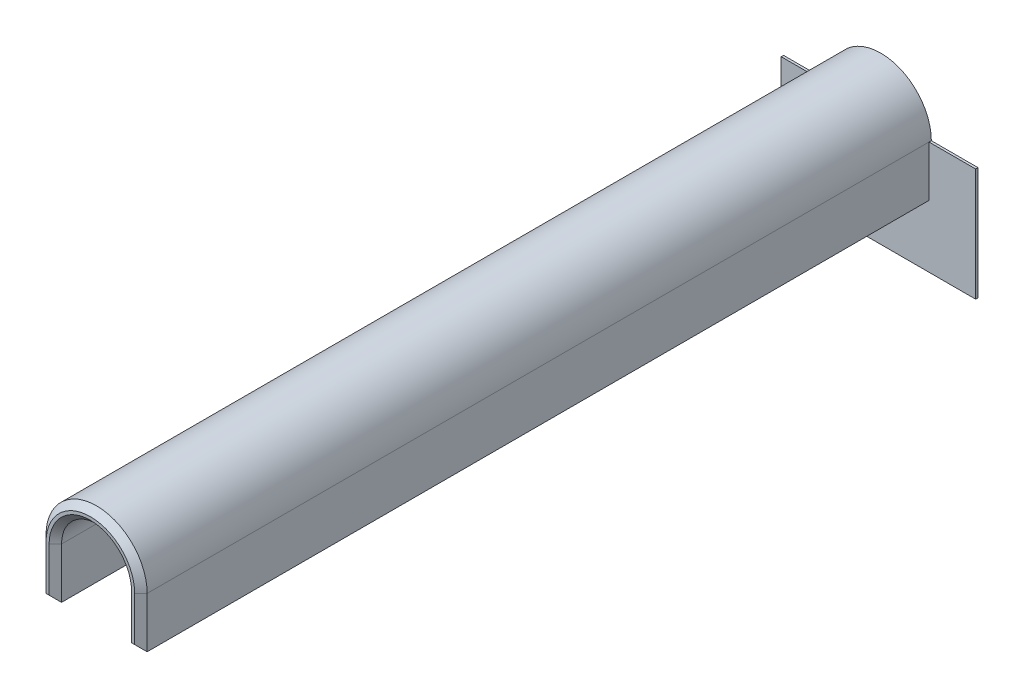
from build123d import *

# Parameters (mm, degrees)
BOSS_EXTRUDE1_DEPTH = 101.6
BOSS_EXTRUDE2_DEPTH = 0.3
CHAMFER1_SIZE       = 0.8


with BuildPart() as part:
    # Sketch1 → Boss-Extrude1 (new body)
    with BuildSketch(Plane.XY):
        with BuildLine():
            Line((-4.5, 0), (-4.5, -6.5))
            Line((-4.5, -6.5), (-6.5, -6.5))
            Line((-6.5, -6.5), (-6.5, 0))
            ThreePointArc((-6.5, 0), (0, 6.5), (6.5, 0))
            Line((6.5, 0), (6.5, -6.5))
            Line((6.5, -6.5), (4.5, -6.5))
            Line((4.5, -6.5), (4.5, 0))
            ThreePointArc((4.5, 0), (0, 4.5), (-4.5, 0))
        make_face()
    extrude(amount=BOSS_EXTRUDE1_DEPTH)

    # Sketch2 → Boss-Extrude2 (add)
    with BuildSketch(Plane(origin=(0, 0, 0), x_dir=(-1, 0, 0), z_dir=(0, 0, -1))):
        Polygon((4.5, 0), (4.5, -6.5), (-4.5, -6.5), (-4.5, 0), (-12.5, 0), (-12.5, -14.5), (12.5, -14.5), (12.5, 0), align=None)
    extrude(amount=-BOSS_EXTRUDE2_DEPTH)

    # Chamfer1
    chamfer1_edges = [part.edges().sort_by_distance(p)[0] for p in [
        (5.5, -6.5, 101.6),
        (6.5, -3.25, 101.6),
        (0, 6.5, 101.6),
        (-6.5, -3.25, 101.6),
        (-5.5, -6.5, 101.6),
        (-4.5, -3.25, 101.6),
        (0, 4.5, 101.6),
        (4.5, -3.25, 101.6),
    ]]
    chamfer(chamfer1_edges, length=CHAMFER1_SIZE)


solid = part.part
